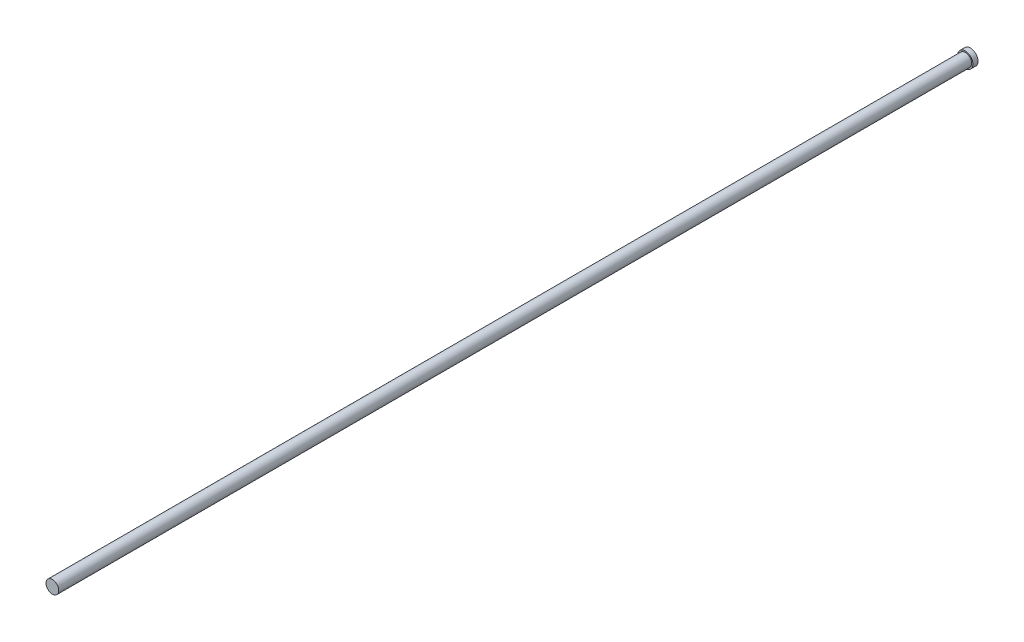
from build123d import *

# Parameters (mm, degrees)
SKETCH2_R           = 2.5
BOSS_EXTRUDE1_DEPTH = 358.39
SKETCH2_5_R         = 3
BOSS_EXTRUDE2_DEPTH = 2


with BuildPart() as part:
    # Sketch2 → Boss-Extrude1 (new body)
    with BuildSketch(Plane.XY):
        with Locations((-13.086903186, 5.549189199)):
            Circle(SKETCH2_R)
    extrude(amount=BOSS_EXTRUDE1_DEPTH)

    # Sketch2<5> → Boss-Extrude2 (add)
    with BuildSketch(Plane.XY):
        with Locations((-13.087932039, 5.568430377)):
            Circle(SKETCH2_5_R)
    extrude(amount=-BOSS_EXTRUDE2_DEPTH)


solid = part.part
